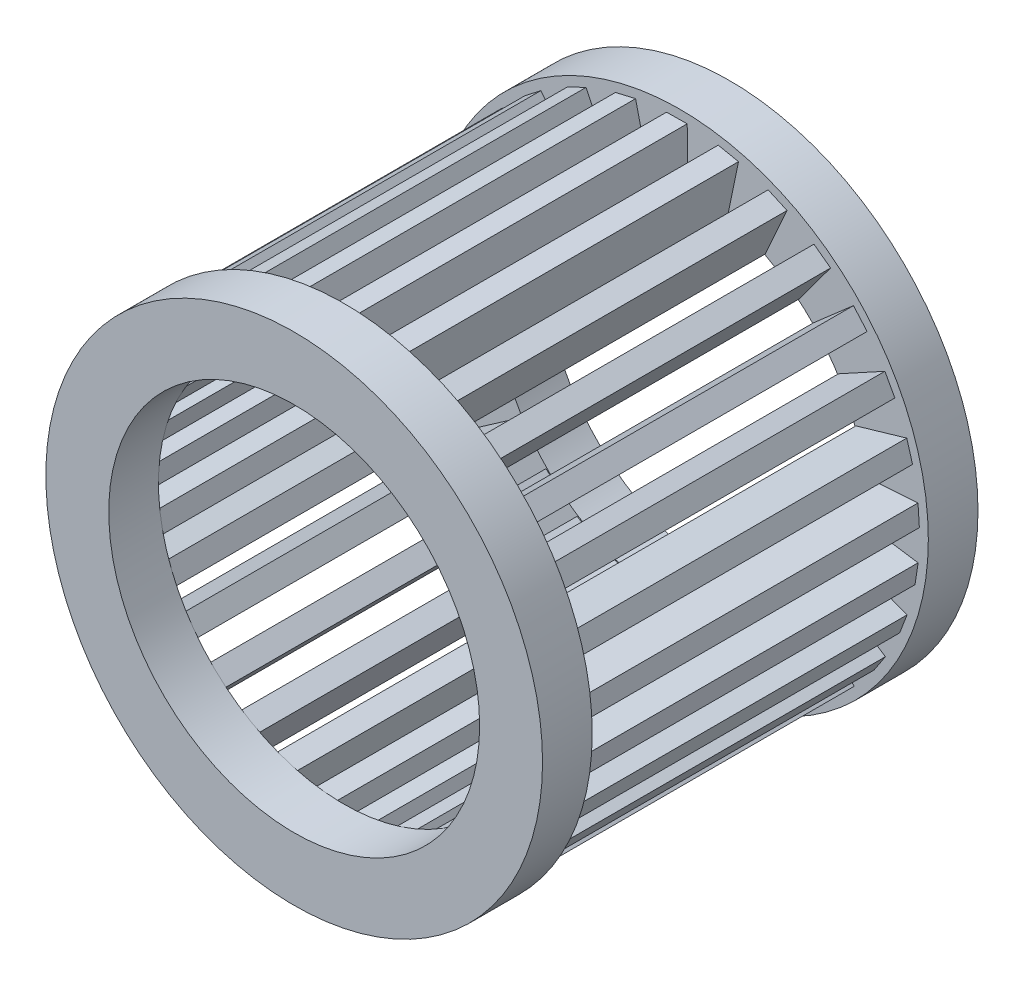
from build123d import *

# Parameters (mm, degrees)
BARS_START           = -20.4
BARS_DEPTH           = 40.8
BARS_2_DEPTH         = 40.8
BARS_3_DEPTH         = 40.8
BARS_4_DEPTH         = 40.8
BARS_5_DEPTH         = 40.8
BARS_6_DEPTH         = 40.8
BARS_7_DEPTH         = 40.8
BARS_8_DEPTH         = 40.8
BARS_9_DEPTH         = 40.8
BARS_10_DEPTH        = 40.8
BARS_11_DEPTH        = 40.8
BARS_12_DEPTH        = 40.8
BARS_13_DEPTH        = 40.8
BARS_14_DEPTH        = 40.8
BARS_15_DEPTH        = 40.8
BARS_16_DEPTH        = 40.8
BARS_17_DEPTH        = 40.8
BARS_18_DEPTH        = 40.8
BARS_19_DEPTH        = 40.8
BARS_20_DEPTH        = 40.8
BARS_21_DEPTH        = 40.8
BARS_22_DEPTH        = 40.8
BARS_23_DEPTH        = 40.8
BARS_24_DEPTH        = 40.8
BARS_25_DEPTH        = 40.8
BARS_26_DEPTH        = 40.8
BARS_27_DEPTH        = 40.8
BARS_28_DEPTH        = 40.8
BARS_29_DEPTH        = 40.8
END_RING_FRONT_START = 20.3
SKETCH_2_R           = 30
SKETCH_2_R_2         = 22.4
END_RING_FRONT_DEPTH = 6
END_RING_REAR_START  = -26.3
SKETCH_3_R           = 30
SKETCH_3_R_2         = 22.4
END_RING_REAR_DEPTH  = 6


with BuildPart() as part:
    # Эскиз1 → Bars (new body)
    with BuildSketch(Plane.XY.offset(BARS_START)):
        Polygon((22.533161901, 0.262896843), (28.918731651, 0.692430264), (28.750945159, 3.186793448), (22.365375408, 2.757260027), align=None)
    extrude(amount=BARS_DEPTH)



with BuildPart() as body_2:
    # Эскиз1 → Bars 2 (new body)
    with BuildSketch(Plane.XY.offset(BARS_START)):
        Polygon((21.949834048, 5.100714194), (28.093775737, 6.892914103), (27.393697648, 9.292891325), (21.249755958, 7.500691416), align=None)
    extrude(amount=BARS_2_DEPTH)


with BuildPart() as body_3:
    # Эскиз1 → Bars 3 (new body)
    with BuildSketch(Plane.XY.offset(BARS_START)):
        Polygon((20.34015635, 9.700027818), (25.955186093, 12.771092939), (24.755551281, 14.964463933), (19.140521537, 11.893398812), align=None)
    extrude(amount=BARS_3_DEPTH)


with BuildPart() as body_4:
    # Эскиз1 → Bars 4 (new body)
    with BuildSketch(Plane.XY.offset(BARS_START)):
        Polygon((17.779395547, 13.845778923), (22.602960795, 18.052109663), (20.959862849, 19.936314838), (16.136297602, 15.729984098), align=None)
    extrude(amount=BARS_4_DEPTH)


with BuildPart() as body_5:
    # Эскиз1 → Bars 5 (new body)
    with BuildSketch(Plane.XY.offset(BARS_START)):
        Polygon((14.387289969, 17.344116793), (18.193846171, 22.489029803), (16.184114527, 23.97596582), (12.377558325, 18.83105281), align=None)
    extrude(amount=BARS_5_DEPTH)


with BuildPart() as body_6:
    # Эскиз1 → Bars 6 (new body)
    with BuildSketch(Plane.XY.offset(BARS_START)):
        Polygon((10.322450703, 20.031463039), (12.934007522, 25.874387904), (10.651614996, 26.894527287), (8.040058177, 21.051602421), align=None)
    extrude(amount=BARS_6_DEPTH)


with BuildPart() as body_7:
    # Эскиз1 → Bars 7 (new body)
    with BuildSketch(Plane.XY.offset(BARS_START)):
        Polygon((5.774945114, 21.782160337), (7.069389055, 28.049888385), (4.621057787, 28.555530549), (3.326613846, 22.287802501), align=None)
    extrude(amount=BARS_7_DEPTH)


with BuildPart() as body_8:
    # Эскиз1 → Bars 8 (new body)
    with BuildSketch(Plane.XY.offset(BARS_START)):
        Polygon((0.95740951, 22.514348026), (0.874213814, 28.913807259), (-1.625574949, 28.88130894), (-1.542379252, 22.481849707), align=None)
    extrude(amount=BARS_8_DEPTH)


with BuildPart() as body_9:
    # Эскиз1 → Bars 9 (new body)
    with BuildSketch(Plane.XY.offset(BARS_START)):
        Polygon((-3.904893498, 22.193789824), (-5.361838694, 28.425748641), (-7.796197607, 27.856629424), (-6.339252411, 21.624670607), align=None)
    extrude(amount=BARS_9_DEPTH)


with BuildPart() as body_10:
    # Эскиз1 → Bars 10 (new body)
    with BuildSketch(Plane.XY.offset(BARS_START)):
        Polygon((-8.584608027, 20.835474677), (-11.347177584, 26.60853361), (-13.602278729, 25.529404877), (-10.839709172, 19.756345944), align=None)
    extrude(amount=BARS_10_DEPTH)


with BuildPart() as body_11:
    # Эскиз1 → Bars 11 (new body)
    with BuildSketch(Plane.XY.offset(BARS_START)):
        Polygon((-12.862915825, 18.502915891), (-16.801935061, 23.547133121), (-18.772332416, 22.008453732), (-14.83331318, 16.964236502), align=None)
    extrude(amount=BARS_11_DEPTH)


with BuildPart() as body_12:
    # Эскиз1 → Bars 12 (new body)
    with BuildSketch(Plane.XY.offset(BARS_START)):
        Polygon((-16.539767975, 15.305181323), (-21.471052729, 19.384694857), (-23.064612703, 17.45841175), (-18.13332795, 13.378898216), align=None)
    extrude(amount=BARS_12_DEPTH)


with BuildPart() as body_13:
    # Эскиз1 → Bars 13 (new body)
    with BuildSketch(Plane.XY.offset(BARS_START)):
        Polygon((-19.443238958, 11.391793486), (-25.136207835, 14.315849807), (-26.278417335, 12.092033839), (-20.585448458, 9.167977519), align=None)
    extrude(amount=BARS_13_DEPTH)


with BuildPart() as body_14:
    # Эскиз1 → Bars 14 (new body)
    with BuildSketch(Plane.XY.offset(BARS_START)):
        Polygon((-21.437565696, 6.945738047), (-27.626021799, 8.57761153), (-28.263472378, 6.160245865), (-22.075016276, 4.528372382), align=None)
    extrude(amount=BARS_14_DEPTH)


with BuildPart() as body_15:
    # Эскиз1 → Bars 15 (new body)
    with BuildSketch(Plane.XY.offset(BARS_START)):
        Polygon((-22.429495689, 2.174907617), (-28.824073688, 2.438293672), (-28.926958866, -0.059588359), (-22.532380867, -0.322974414), align=None)
    extrude(amount=BARS_15_DEPTH)


with BuildPart() as body_16:
    # Эскиз1 → Bars 16 (new body)
    with BuildSketch(Plane.XY.offset(BARS_START)):
        Polygon((-22.372647392, -2.697619077), (-28.674343927, -3.815036088), (-28.237852907, -6.276636298), (-21.936156372, -5.159219286), align=None)
    extrude(amount=BARS_16_DEPTH)


with BuildPart() as body_17:
    # Эскиз1 → Bars 17 (new body)
    with BuildSketch(Plane.XY.offset(BARS_START)):
        Polygon((-21.269678968, -7.4440081), (-27.183833713, -9.889979002), (-26.22837633, -12.200195699), (-20.314221585, -9.754224798), align=None)
    extrude(amount=BARS_17_DEPTH)


with BuildPart() as body_18:
    # Эскиз1 → Bars 18 (new body)
    with BuildSketch(Plane.XY.offset(BARS_START)):
        Polygon((-19.172163995, -11.842323579), (-24.422237648, -15.502477488), (-22.992490027, -17.553287509), (-17.742416374, -13.893133599), align=None)
    extrude(amount=BARS_18_DEPTH)


with BuildPart() as body_19:
    # Эскиз1 → Bars 19 (new body)
    with BuildSketch(Plane.XY.offset(BARS_START)):
        Polygon((-16.178179942, -15.686905168), (-20.518684893, -20.390097358), (-18.681500444, -22.085607104), (-14.340995493, -17.382414915), align=None)
    extrude(amount=BARS_19_DEPTH)


with BuildPart() as body_20:
    # Эскиз1 → Bars 20 (new body)
    with BuildSketch(Plane.XY.offset(BARS_START)):
        Polygon((-12.427722176, -18.797984507), (-15.655701238, -24.324298936), (-13.496984664, -25.585228257), (-10.269005602, -20.058913828), align=None)
    extrude(amount=BARS_20_DEPTH)


with BuildPart() as body_21:
    # Эскиз1 → Bars 21 (new body)
    with BuildSketch(Plane.XY.offset(BARS_START)):
        Polygon((-8.096157933, -21.030090982), (-10.060674393, -27.121123332), (-7.681364881, -27.888512573), (-5.716848422, -21.797480224), align=None)
    extrude(amount=BARS_21_DEPTH)


with BuildPart() as body_22:
    # Эскиз1 → Bars 22 (new body)
    with BuildSketch(Plane.XY.offset(BARS_START)):
        Polygon((-3.386026344, -22.278853777), (-3.995221595, -28.649794143), (-1.506573014, -28.887761037), (-0.897377763, -22.516820671), align=None)
    extrude(amount=BARS_22_DEPTH)


with BuildPart() as body_23:
    # Эскиз1 → Bars 23 (new body)
    with BuildSketch(Plane.XY.offset(BARS_START)):
        Polygon((1.482432074, -22.48588213), (2.257043325, -28.838832421), (4.738664533, -28.536249902), (3.964053282, -22.18329961), align=None)
    extrude(amount=BARS_23_DEPTH)


with BuildPart() as body_24:
    # Эскиз1 → Bars 24 (new body)
    with BuildSketch(Plane.XY.offset(BARS_START)):
        Polygon((6.281573616, -21.641495625), (8.403771407, -27.679398948), (10.762327392, -26.850415436), (8.640129601, -20.812512113), align=None)
    extrude(amount=BARS_24_DEPTH)


with BuildPart() as body_25:
    # Эскиз1 → Bars 25 (new body)
    with BuildSketch(Plane.XY.offset(BARS_START)):
        Polygon((10.786995757, -19.785176839), (14.157548478, -25.225707544), (16.282755785, -23.909085387), (12.912203064, -18.468554682), align=None)
    extrude(amount=BARS_25_DEPTH)


with BuildPart() as body_26:
    # Эскиз1 → Bars 26 (new body)
    with BuildSketch(Plane.XY.offset(BARS_START)):
        Polygon((14.788029965, -17.003725173), (19.249334318, -21.592490091), (21.041820614, -19.849793078), (16.580516262, -15.26102816), align=None)
    extrude(amount=BARS_26_DEPTH)


with BuildPart() as body_27:
    # Эскиз1 → Bars 27 (new body)
    with BuildSketch(Plane.XY.offset(BARS_START)):
        Polygon((18.097592328, -13.427198216), (23.441042678, -16.9496318), (24.816993297, -14.862346507), (19.473542947, -11.339912923), align=None)
    extrude(amount=BARS_27_DEPTH)


with BuildPart() as body_28:
    # Эскиз1 → Bars 28 (new body)
    with BuildSketch(Plane.XY.offset(BARS_START)):
        Polygon((20.560931388, -9.222830393), (26.536673936, -11.514227564), (27.431750956, -9.179953131), (21.456008407, -6.88855596), align=None)
    extrude(amount=BARS_28_DEPTH)


with BuildPart() as body_29:
    # Эскиз1 → Bars 29 (new body)
    with BuildSketch(Plane.XY.offset(BARS_START)):
        Polygon((22.062864148, -4.587213273), (28.391479815, -5.540430844), (28.763830428, -3.068315349), (22.435214761, -2.115097778), align=None)
    extrude(amount=BARS_29_DEPTH)


with BuildPart() as part_1:
    add(part.part)

    add(body_2.part)  # End_ring_front merges body 2

    add(body_3.part)  # End_ring_front merges body 3

    add(body_4.part)  # End_ring_front merges body 4

    add(body_5.part)  # End_ring_front merges body 5

    add(body_6.part)  # End_ring_front merges body 6

    add(body_7.part)  # End_ring_front merges body 7

    add(body_8.part)  # End_ring_front merges body 8

    add(body_9.part)  # End_ring_front merges body 9

    add(body_10.part)  # End_ring_front merges body 10

    add(body_11.part)  # End_ring_front merges body 11

    add(body_12.part)  # End_ring_front merges body 12

    add(body_13.part)  # End_ring_front merges body 13

    add(body_14.part)  # End_ring_front merges body 14

    add(body_15.part)  # End_ring_front merges body 15

    add(body_16.part)  # End_ring_front merges body 16

    add(body_17.part)  # End_ring_front merges body 17

    add(body_18.part)  # End_ring_front merges body 18

    add(body_19.part)  # End_ring_front merges body 19

    add(body_20.part)  # End_ring_front merges body 20

    add(body_21.part)  # End_ring_front merges body 21

    add(body_22.part)  # End_ring_front merges body 22

    add(body_23.part)  # End_ring_front merges body 23

    add(body_24.part)  # End_ring_front merges body 24

    add(body_25.part)  # End_ring_front merges body 25

    add(body_26.part)  # End_ring_front merges body 26

    add(body_27.part)  # End_ring_front merges body 27

    add(body_28.part)  # End_ring_front merges body 28

    add(body_29.part)  # End_ring_front merges body 29
    # Эскиз2 → End_ring_front (add)
    with BuildSketch(Plane.XY.offset(END_RING_FRONT_START)):
        Circle(SKETCH_2_R)
        Circle(SKETCH_2_R_2, mode=Mode.SUBTRACT)
    extrude(amount=END_RING_FRONT_DEPTH)

    # Эскиз3 → End_ring_rear (add)
    with BuildSketch(Plane.XY.offset(END_RING_REAR_START)):
        Circle(SKETCH_3_R)
        Circle(SKETCH_3_R_2, mode=Mode.SUBTRACT)
    extrude(amount=END_RING_REAR_DEPTH)


solid = part_1.part
